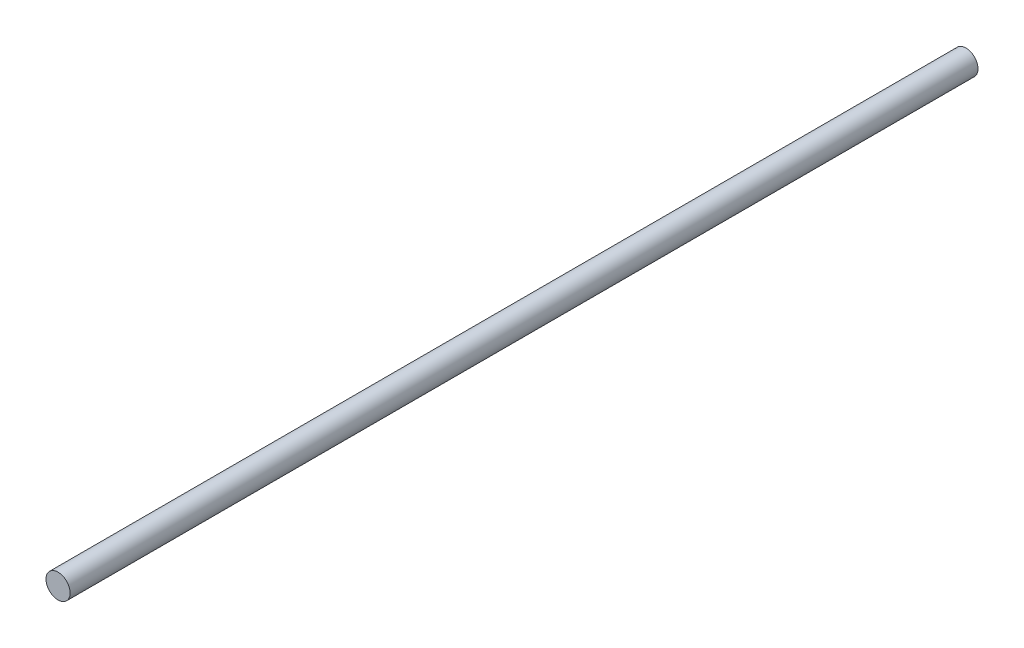
from build123d import *

# Parameters (mm, degrees)
SKETCH1_R           = 1.25
BOSS_EXTRUDE1_DEPTH = 94


with BuildPart() as part:
    # Sketch1 → Boss-Extrude1 (new body)
    with BuildSketch(Plane.XY):
        Circle(SKETCH1_R)
    extrude(amount=-BOSS_EXTRUDE1_DEPTH)


solid = part.part
